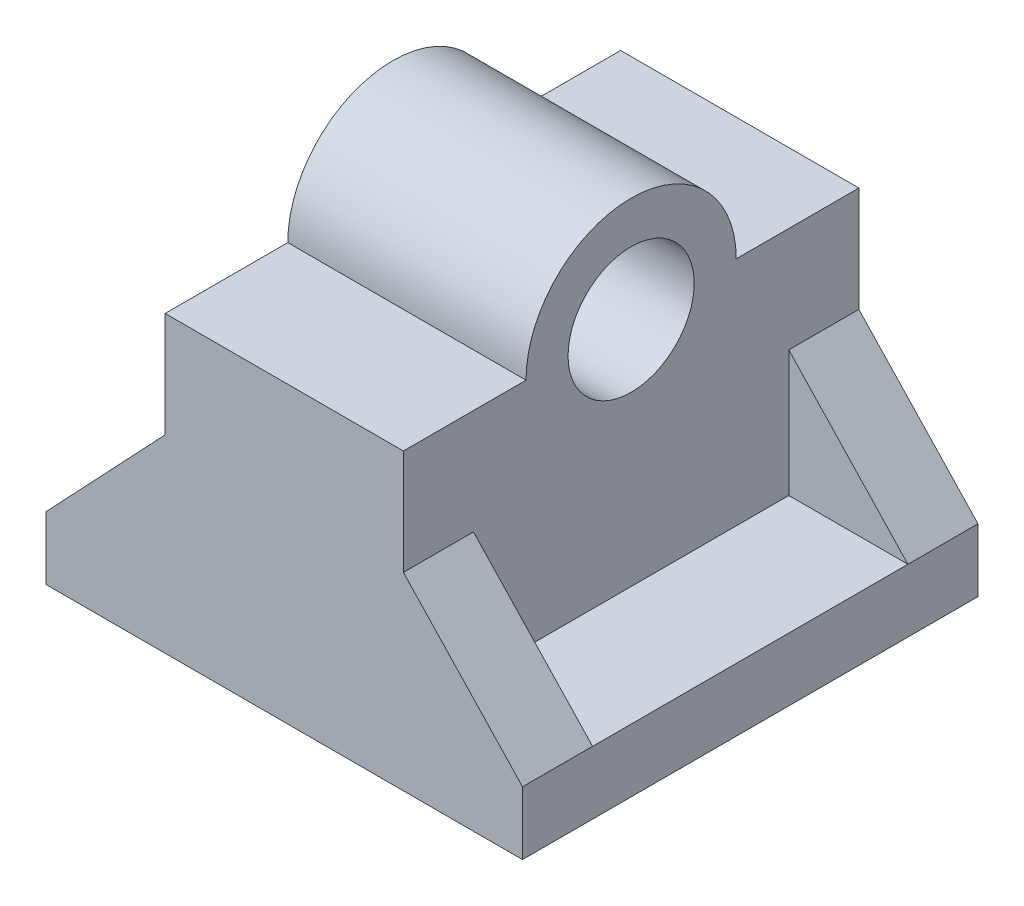
from build123d import *

# Parameters (mm, degrees)
BOSS_EXTRUDE1_DEPTH = 65
SKETCH2_R           = 15
BOSS_EXTRUDE2_DEPTH = 34
SKETCH3_R           = 9
CUT_EXTRUDE1_DEPTH  = 34
SKETCH4_W           = 45
SKETCH4_H           = 18
CUT_EXTRUDE2_DEPTH  = 17


with BuildPart() as part:
    # Sketch1 → Boss-Extrude1 (new body)
    with BuildSketch(Plane.XY):
        Polygon((-34, 0), (-34, 9), (-17, 27), (-17, 42), (17, 42), (17, 27), (34, 9), (34, 0), align=None)
    extrude(amount=-BOSS_EXTRUDE1_DEPTH)

    # Sketch2 → Boss-Extrude2 (add)
    with BuildSketch(Plane.ZY.offset(17)):
        with Locations((-32.5, 42)):
            Circle(SKETCH2_R)
    extrude(amount=-BOSS_EXTRUDE2_DEPTH)

    # Sketch3 → Cut-Extrude1 (cut)
    with BuildSketch(Plane.ZY.offset(17)):
        with Locations((-32.5, 42)):
            Circle(SKETCH3_R)
    extrude(amount=-CUT_EXTRUDE1_DEPTH, mode=Mode.SUBTRACT)

    # Sketch4 → Cut-Extrude2 (cut)
    with BuildSketch(Plane(origin=(-34, 0, 0), x_dir=(0, 0, -1), z_dir=(1, 0, 0))):
        with Locations((32.5, 18)):
            Rectangle(SKETCH4_W, SKETCH4_H)
    cut_extrude2 = extrude(amount=CUT_EXTRUDE2_DEPTH, mode=Mode.SUBTRACT)

    # Mirror1: Cut-Extrude2 across plane
    add(cut_extrude2.mirror(Plane(origin=(0, 0, 0), x_dir=(0, 0, 1), z_dir=(1, 0, 0))), mode=Mode.SUBTRACT)


solid = part.part
